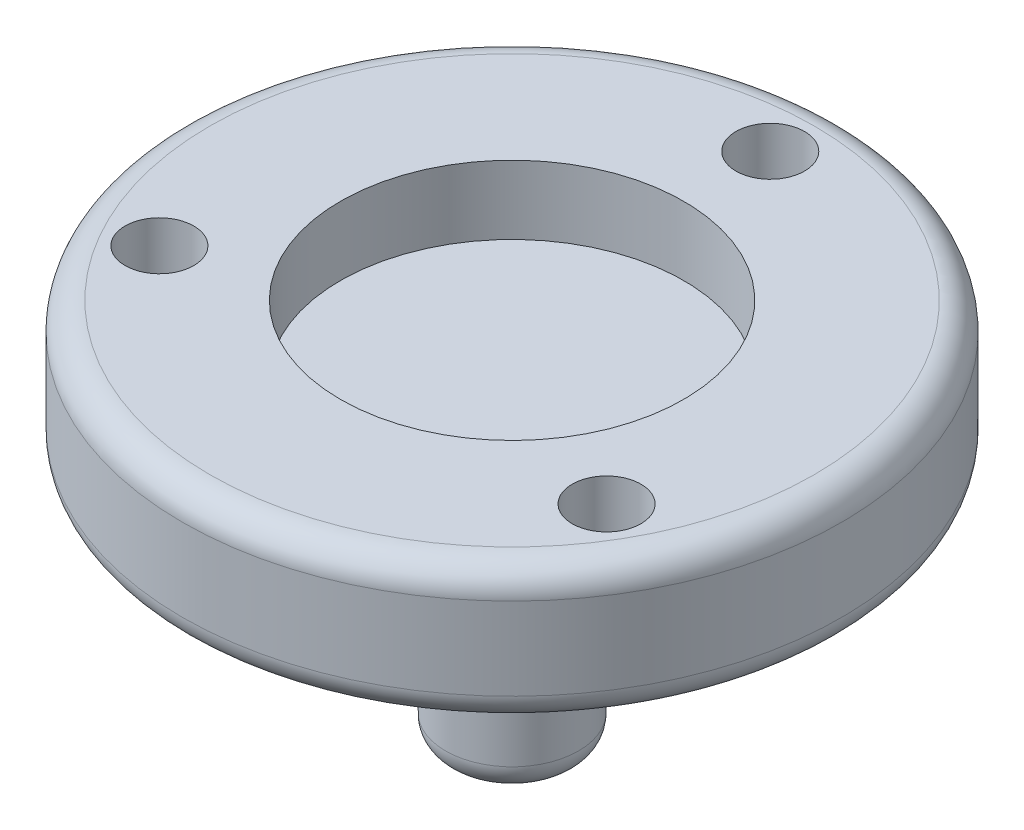
from build123d import *

# Parameters (mm, degrees)
SKETCH1_R           = 15.24
BOSS_EXTRUDE1_DEPTH = 6.35
SKETCH2_R           = 7.9375
CUT_EXTRUDE1_DEPTH  = 3.175
FILLET4_R           = 1.27
SKETCH4_R           = 1.5875
CUT_EXTRUDE2_DEPTH  = 2.54
CIRPATTERN1_COUNT   = 3
FILLET6_R           = 1.27
SKETCH3_R           = 3.0734
BOSS_EXTRUDE4_DEPTH = 11.43
FILLET7_R           = 1.27


with BuildPart() as part:
    # Sketch1 → Boss-Extrude1 (new body)
    with BuildSketch(Plane(origin=(0, 0, 0), x_dir=(1, 0, 0), z_dir=(0, 1, 0))):
        Circle(SKETCH1_R)
    extrude(amount=BOSS_EXTRUDE1_DEPTH)

    # Sketch2 → Cut-Extrude1 (cut)
    with BuildSketch(Plane(origin=(0, 6.35, 0), x_dir=(1, 0, 0), z_dir=(0, 1, 0))):
        Circle(SKETCH2_R)
    extrude(amount=-CUT_EXTRUDE1_DEPTH, mode=Mode.SUBTRACT)

    # Fillet4
    fillet4_edges = [part.edges().sort_by_distance(p)[0] for p in [
        (-15.24, 6.35, 0),
    ]]
    fillet(fillet4_edges, radius=FILLET4_R)

    # Sketch4 → Cut-Extrude2 (cut)
    with BuildSketch(Plane(origin=(0, 6.35, 0), x_dir=(1, 0, 0), z_dir=(0, 1, 0))):
        with Locations((0, 11.938)):
            Circle(SKETCH4_R)
    cut_extrude2 = extrude(amount=-CUT_EXTRUDE2_DEPTH, mode=Mode.SUBTRACT)

    # CirPattern1: Cut-Extrude2 ×3 about axis
    cirpattern1_axis = Axis((0, 3.175, 0), (0, 1, 0))
    for i in range(1, CIRPATTERN1_COUNT):
        add(cut_extrude2.rotate(cirpattern1_axis, i * 360 / CIRPATTERN1_COUNT), mode=Mode.SUBTRACT)

    # Fillet6
    fillet6_edges = [part.edges().sort_by_distance(p)[0] for p in [
        (-15.24, 0, 0),
    ]]
    fillet(fillet6_edges, radius=FILLET6_R)

    # Sketch3 → Boss-Extrude4 (add)
    with BuildSketch(Plane.XZ):
        Circle(SKETCH3_R)
    extrude(amount=BOSS_EXTRUDE4_DEPTH)

    # Fillet7
    fillet7_edges = [part.edges().sort_by_distance(p)[0] for p in [
        (-3.0734, -11.43, 0),
        (-3.0734, 0, 0),
    ]]
    fillet(fillet7_edges, radius=FILLET7_R)


solid = part.part
